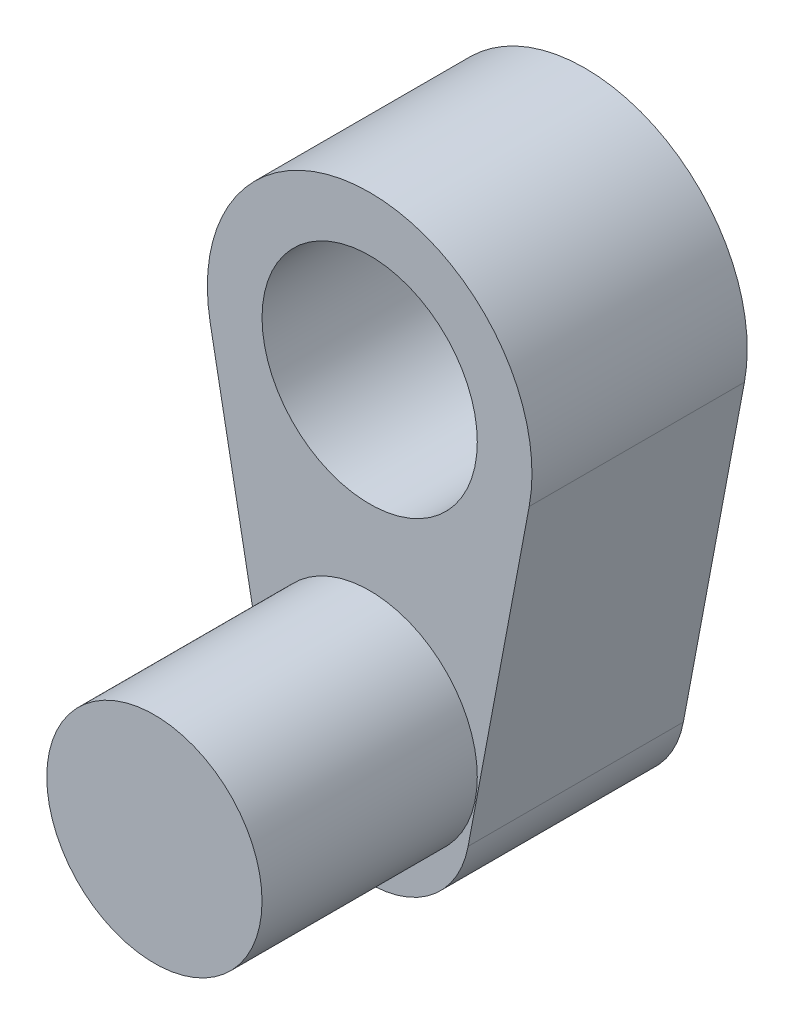
from build123d import *

# Parameters (mm, degrees)
SKETCH2_R           = 2.5
BOSS_EXTRUDE1_DEPTH = 5
SKETCH5_R           = 2.5
BOSS_EXTRUDE2_DEPTH = 5
SCALE1_SCALE        = 0.6


with BuildPart() as part:
    # Sketch2 → Boss-Extrude1 (new body)
    with BuildSketch(Plane.XY):
        with BuildLine():
            Line((-3.705099972, 4.386006173), (-2.28681669, -3.158891918))
            ThreePointArc((-2.28681669, -3.158891918), (0, -5.055887715), (2.28681669, -3.158891918))
            Line((2.28681669, -3.158891918), (3.705099972, 4.386006173))
            ThreePointArc((3.705099972, 4.386006173), (0, 8.852481252), (-3.705099972, 4.386006173))
        make_face()
        with Locations((0, 5.082487595)):
            Circle(SKETCH2_R, mode=Mode.SUBTRACT)
    extrude(amount=BOSS_EXTRUDE1_DEPTH)

    # Sketch5 → Boss-Extrude2 (add)
    with BuildSketch(Plane.XY.offset(5)):
        with Locations(Location((0, -1.656861976, 0), (0, 0, 180))):
            Circle(SKETCH5_R)
    extrude(amount=BOSS_EXTRUDE2_DEPTH)


with BuildPart() as part_1:
    # Scale1: scaled about (0, 0, 0)
    add(part.part.scale(SCALE1_SCALE))


solid = part_1.part
